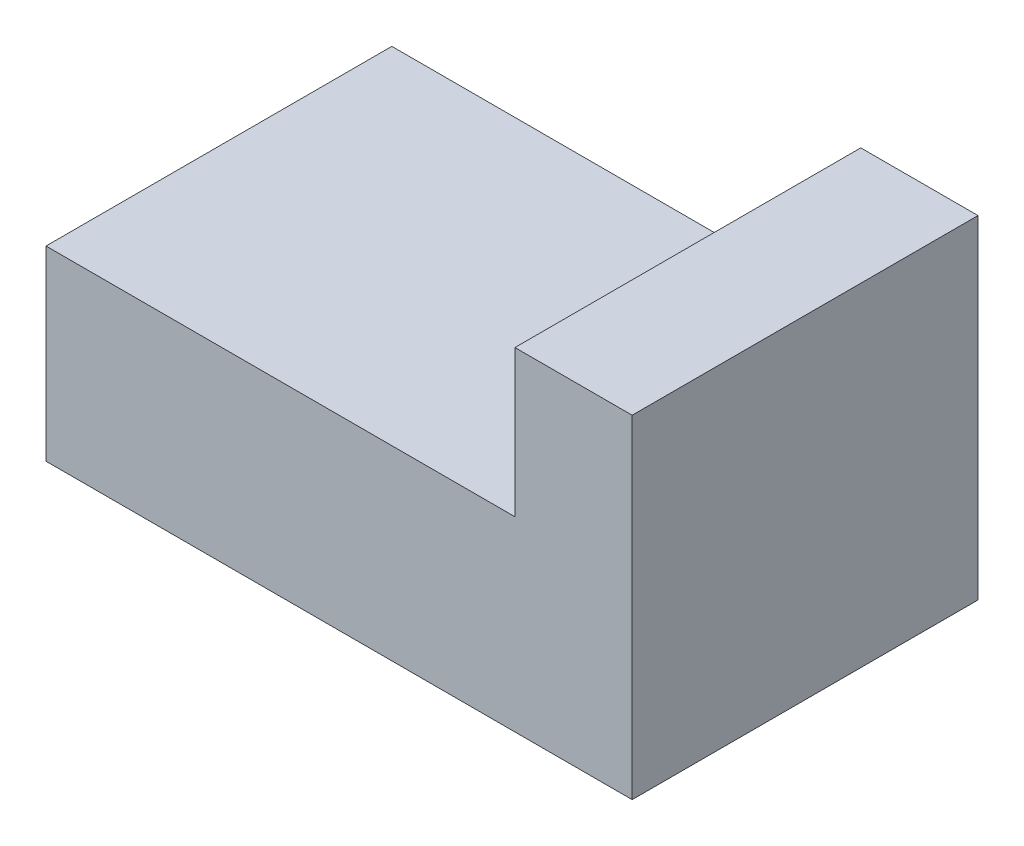
from build123d import *

# Parameters (mm, degrees)
SKETCH1_W           = 10
SKETCH1_H           = 5.9
BOSS_EXTRUDE1_DEPTH = 3.18
SKETCH2_W           = 2
SKETCH2_H           = 5.9
BOSS_EXTRUDE2_DEPTH = 2.5


with BuildPart() as part:
    # Sketch1 → Boss-Extrude1 (new body)
    with BuildSketch(Plane(origin=(0, 0, 0), x_dir=(1, 0, 0), z_dir=(0, 1, 0))):
        with Locations((5, -2.95)):
            Rectangle(SKETCH1_W, SKETCH1_H)
    extrude(amount=BOSS_EXTRUDE1_DEPTH)

    # Sketch2 → Boss-Extrude2 (add)
    with BuildSketch(Plane(origin=(0, 3.18, 0), x_dir=(1, 0, 0), z_dir=(0, 1, 0))):
        with Locations((9, -2.95)):
            Rectangle(SKETCH2_W, SKETCH2_H)
    extrude(amount=BOSS_EXTRUDE2_DEPTH)


solid = part.part
